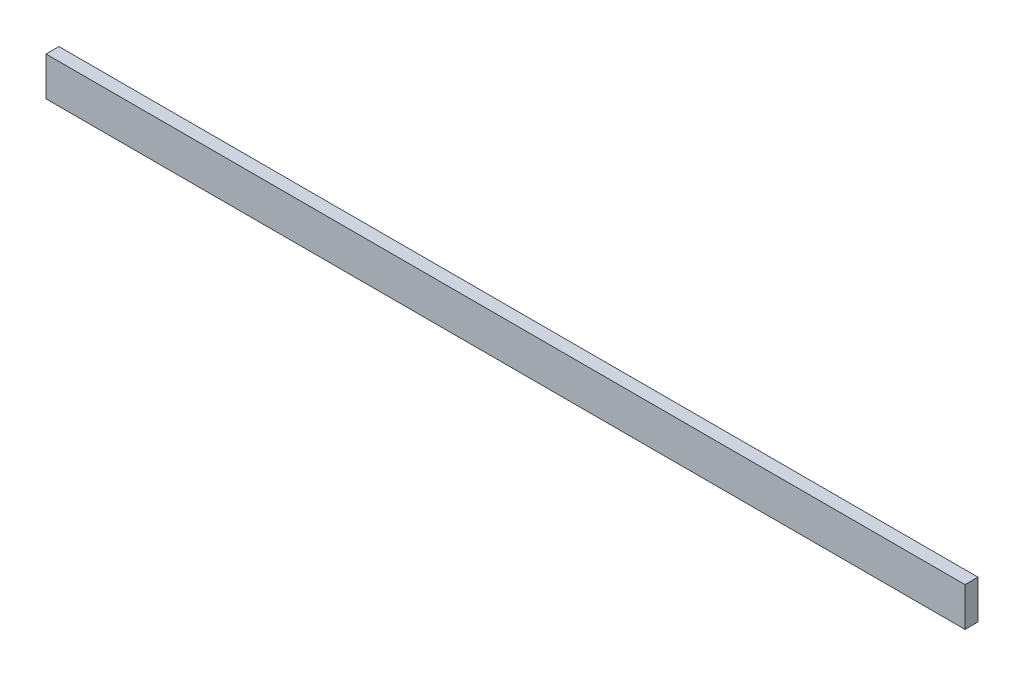
from build123d import *

# Parameters (mm, degrees)
SKETCH1_W           = 901.7
SKETCH1_H           = 38.1
BOSS_EXTRUDE1_DEPTH = 12.7


with BuildPart() as part:
    # Sketch1 → Boss-Extrude1 (new body)
    with BuildSketch(Plane.XY):
        with Locations((450.85, 19.05)):
            Rectangle(SKETCH1_W, SKETCH1_H)
    extrude(amount=BOSS_EXTRUDE1_DEPTH)


solid = part.part
